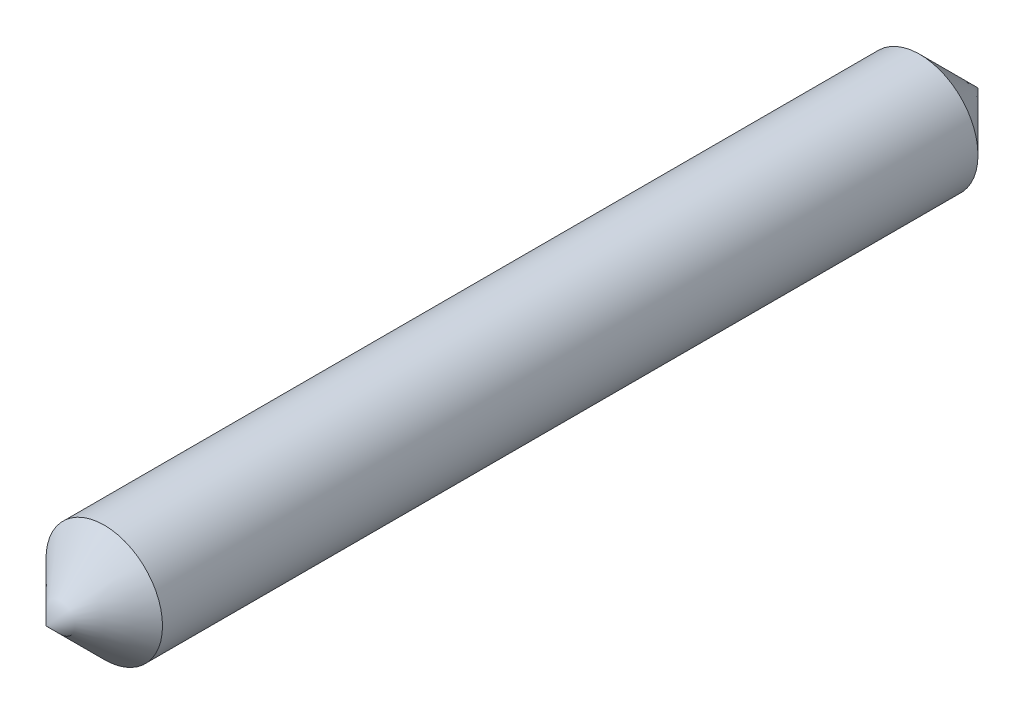
from build123d import *

# Parameters (mm, degrees)
SKETCH1_R           = 0.625
BOSS_EXTRUDE1_DEPTH = 10
CHAMFER1_SIZE       = 0.625


with BuildPart() as part:
    # Sketch1 → Boss-Extrude1 (new body)
    with BuildSketch(Plane.XY):
        Circle(SKETCH1_R)
    extrude(amount=BOSS_EXTRUDE1_DEPTH)

    # Chamfer1
    chamfer1_edges = [part.edges().sort_by_distance(p)[0] for p in [
        (-0.625, 0, 0),
        (-0.625, 0, 10),
    ]]
    chamfer(chamfer1_edges, length=CHAMFER1_SIZE)


solid = part.part
